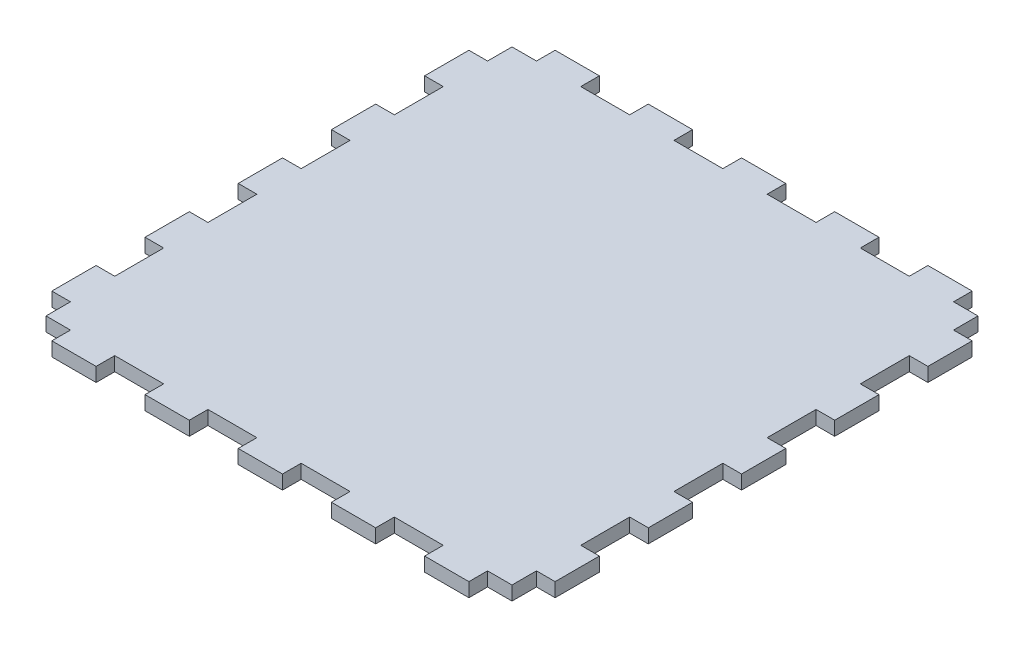
from build123d import *

# Parameters (mm, degrees)
SKETCH2_W           = 100
SKETCH2_H           = 100
BOSS_EXTRUDE1_DEPTH = 3
SKETCH4_W           = 9.5
SKETCH4_H           = 3
BOSS_EXTRUDE2_DEPTH = 4
SKETCH5_W           = 9.5
SKETCH5_H           = 3
BOSS_EXTRUDE3_DEPTH = 4
SKETCH6_W           = 9.5
SKETCH6_H           = 3
BOSS_EXTRUDE4_DEPTH = 4
SKETCH7_W           = 9.5
SKETCH7_H           = 3
BOSS_EXTRUDE5_DEPTH = 4


with BuildPart() as part:
    # Sketch2 → Boss-Extrude1 (new body)
    with BuildSketch(Plane(origin=(0, 0, 0), x_dir=(1, 0, 0), z_dir=(0, 1, 0))):
        Rectangle(SKETCH2_W, SKETCH2_H)
    extrude(amount=BOSS_EXTRUDE1_DEPTH)

    # Sketch4 → Boss-Extrude2 (add)
    with BuildSketch(Plane.XY.offset(50)):
        with Locations((-40, 1.5)):
            Rectangle(SKETCH4_W, SKETCH4_H)
        with Locations((-20, 1.5)):
            Rectangle(SKETCH4_W, SKETCH4_H)
        with Locations((0, 1.5)):
            Rectangle(SKETCH4_W, SKETCH4_H)
        with Locations((20, 1.5)):
            Rectangle(SKETCH4_W, SKETCH4_H)
        with Locations((40, 1.5)):
            Rectangle(SKETCH4_W, SKETCH4_H)
    extrude(amount=BOSS_EXTRUDE2_DEPTH)

    # Sketch5 → Boss-Extrude3 (add)
    with BuildSketch(Plane.ZY.offset(50)):
        with Locations((-40, 1.5)):
            Rectangle(SKETCH5_W, SKETCH5_H)
        with Locations((-20, 1.5)):
            Rectangle(SKETCH5_W, SKETCH5_H)
        with Locations((0, 1.5)):
            Rectangle(SKETCH5_W, SKETCH5_H)
        with Locations((20, 1.5)):
            Rectangle(SKETCH5_W, SKETCH5_H)
        with Locations((40, 1.5)):
            Rectangle(SKETCH5_W, SKETCH5_H)
    extrude(amount=BOSS_EXTRUDE3_DEPTH)

    # Sketch6 → Boss-Extrude4 (add)
    with BuildSketch(Plane(origin=(50, 0, 0), x_dir=(0, 0, -1), z_dir=(1, 0, 0))):
        with Locations((-40, 1.5)):
            Rectangle(SKETCH6_W, SKETCH6_H)
        with Locations((-20, 1.5)):
            Rectangle(SKETCH6_W, SKETCH6_H)
        with Locations((0, 1.5)):
            Rectangle(SKETCH6_W, SKETCH6_H)
        with Locations((20, 1.5)):
            Rectangle(SKETCH6_W, SKETCH6_H)
        with Locations((40, 1.5)):
            Rectangle(SKETCH6_W, SKETCH6_H)
    extrude(amount=BOSS_EXTRUDE4_DEPTH)

    # Sketch7 → Boss-Extrude5 (add)
    with BuildSketch(Plane(origin=(0, 0, -50), x_dir=(-1, 0, 0), z_dir=(0, 0, -1))):
        with Locations((-40, 1.5)):
            Rectangle(SKETCH7_W, SKETCH7_H)
        with Locations((-20, 1.5)):
            Rectangle(SKETCH7_W, SKETCH7_H)
        with Locations((0, 1.5)):
            Rectangle(SKETCH7_W, SKETCH7_H)
        with Locations((20, 1.5)):
            Rectangle(SKETCH7_W, SKETCH7_H)
        with Locations((40, 1.5)):
            Rectangle(SKETCH7_W, SKETCH7_H)
    extrude(amount=BOSS_EXTRUDE5_DEPTH)


solid = part.part
